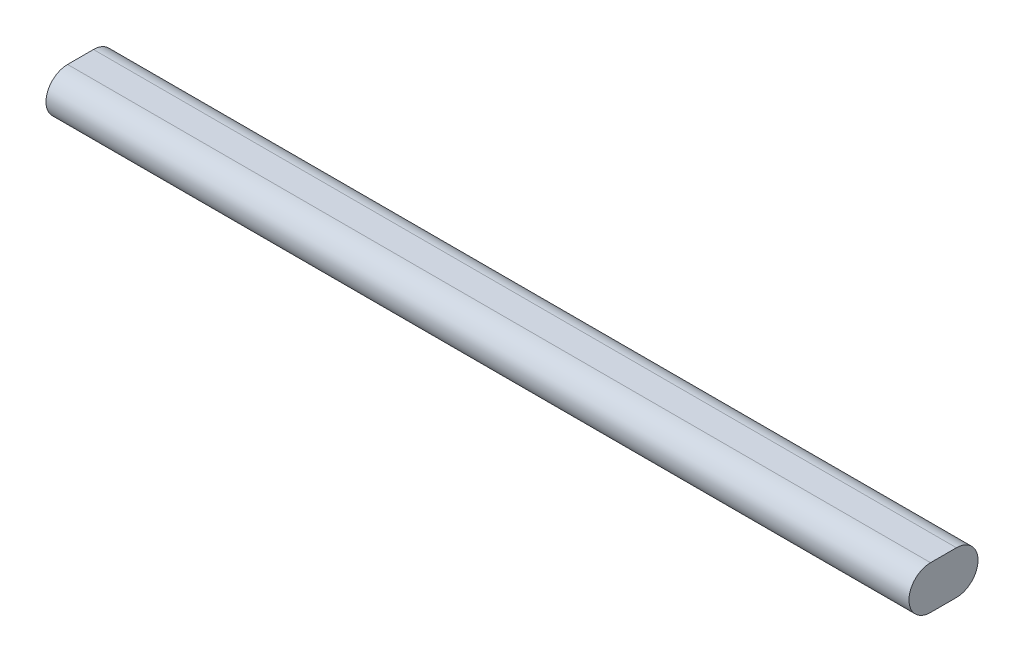
from build123d import *

# Parameters (mm, degrees)
SALIENTE_EXTRUIR1_DEPTH = 500


with BuildPart() as part:
    # Croquis1 → Saliente-Extruir1 (new body)
    with BuildSketch(Plane(origin=(0, 0, 0), x_dir=(0, 0, -1), z_dir=(1, 0, 0))):
        with BuildLine():
            Line((0, 12.5), (15, 12.5))
            ThreePointArc((15, 12.5), (27.5, 0), (15, -12.5))
            Line((15, -12.5), (0, -12.5))
            ThreePointArc((0, -12.5), (-12.5, 0), (0, 12.5))
        make_face()
    extrude(amount=SALIENTE_EXTRUIR1_DEPTH)


solid = part.part
